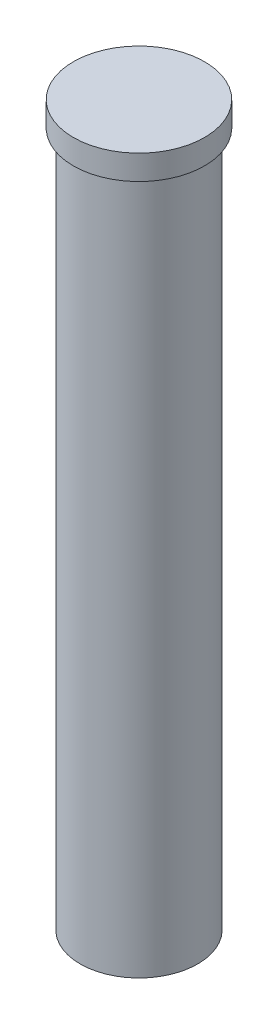
from build123d import *

# Parameters (mm, degrees)
SKETCH1_R           = 2.15
BOSS_EXTRUDE1_DEPTH = 26.3
SKETCH2_R           = 2.4
BOSS_EXTRUDE2_DEPTH = 0.9


with BuildPart() as part:
    # Sketch1 → Boss-Extrude1 (new body)
    with BuildSketch(Plane(origin=(0, 0, 0), x_dir=(1, 0, 0), z_dir=(0, 1, 0))):
        with Locations(Location((0, 0, 0), (0, 0, 270))):
            Circle(SKETCH1_R)
    extrude(amount=BOSS_EXTRUDE1_DEPTH)

    # Sketch2 → Boss-Extrude2 (add)
    with BuildSketch(Plane(origin=(0, 26.3, 0), x_dir=(1, 0, 0), z_dir=(0, 1, 0))):
        with Locations(Location((0, 0, 0), (0, 0, 270))):
            Circle(SKETCH2_R)
    extrude(amount=-BOSS_EXTRUDE2_DEPTH)


solid = part.part
